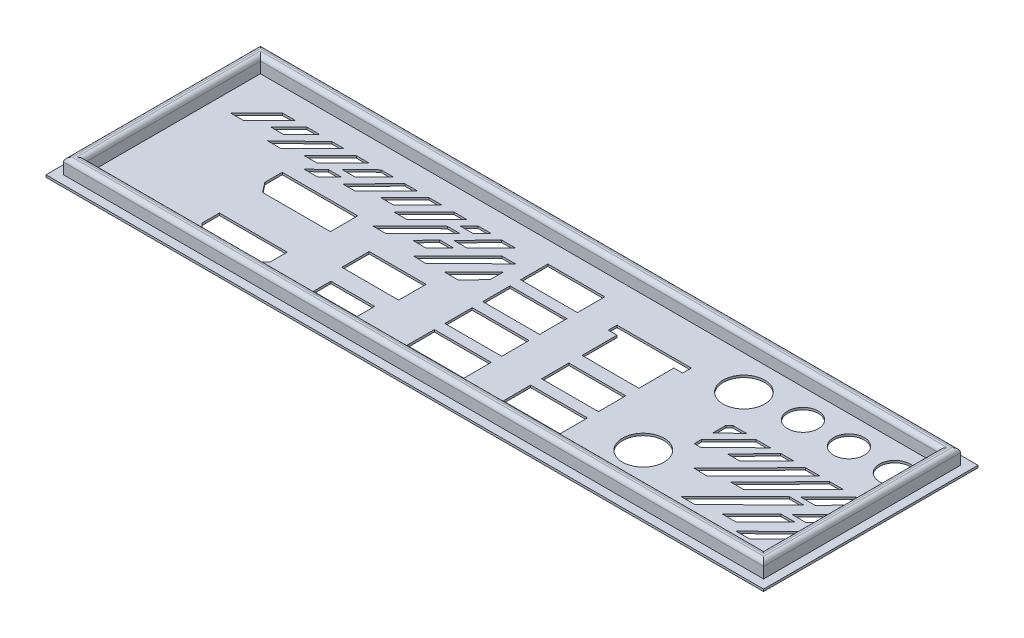
from build123d import *

# Parameters (mm, degrees)
SKETCH1_W           = 155
SKETCH1_H           = 40
BOSS_EXTRUDE1_DEPTH = 0.5
SKETCH2_W           = 160
SKETCH2_H           = 45
SKETCH2_W_2         = 155
SKETCH2_H_2         = 40
BOSS_EXTRUDE2_DEPTH = 4
FILLET1_R           = 1
SKETCH3_W           = 164
SKETCH3_H           = 49
BOSS_EXTRUDE3_DEPTH = 0.5
SKETCH5_R           = 3.5
SKETCH5_R_2         = 4.75
SKETCH5_W           = 13
SKETCH5_H           = 6.25
SKETCH5_W_2         = 10
SKETCH5_H_2         = 4
CUT_EXTRUDE1_DEPTH  = 86.653371212
CUT_EXTRUDE2_DEPTH  = 86.653371212


with BuildPart() as part:
    # Sketch1 → Boss-Extrude1 (new body)
    with BuildSketch(Plane(origin=(0, 0, 0), x_dir=(1, 0, 0), z_dir=(0, 1, 0))):
        Rectangle(SKETCH1_W, SKETCH1_H)
    extrude(amount=BOSS_EXTRUDE1_DEPTH)

    # Sketch2 → Boss-Extrude2 (add)
    with BuildSketch(Plane.XZ):
        Rectangle(SKETCH2_W, SKETCH2_H)
        Rectangle(SKETCH2_W_2, SKETCH2_H_2, mode=Mode.SUBTRACT)
    extrude(amount=-BOSS_EXTRUDE2_DEPTH)

    # Fillet1
    fillet1_edges = [part.edges().sort_by_distance(p)[0] for p in [
        (-80, 4, 0),
        (0, 4, 22.5),
        (80, 4, 0),
        (0, 4, -22.5),
        (77.5, 4, 0),
        (0, 4, 20),
        (-77.5, 4, 0),
        (0, 4, -20),
    ]]
    fillet(fillet1_edges, radius=FILLET1_R)

    # Sketch3 → Boss-Extrude3 (add)
    with BuildSketch(Plane.XZ):
        Rectangle(SKETCH3_W, SKETCH3_H)
    extrude(amount=-BOSS_EXTRUDE3_DEPTH)

    # Sketch5 → Cut-Extrude1 (cut, through all)
    with BuildSketch(Plane(origin=(0, 0.5, 0), x_dir=(1, 0, 0), z_dir=(0, 1, 0))):
        with Locations(Location((74, 13.5, 0), (0, 0, 270))):
            Circle(SKETCH5_R)
        with Locations(Location((63.5, 13.5, 0), (0, 0, 270))):
            Circle(SKETCH5_R)
        with Locations(Location((53, 13.5, 0), (0, 0, 270))):
            Circle(SKETCH5_R)
        with Locations(Location((40.75, 12.25, 0), (0, 0, 270))):
            Circle(SKETCH5_R_2)
        with Locations(Location((40.75, -10.75, 0), (0, 0, 270))):
            Circle(SKETCH5_R_2)
        with Locations((21.5, -13.875)):
            Rectangle(SKETCH5_W, SKETCH5_H)
        with Locations((21.5, -5.125)):
            Rectangle(SKETCH5_W, SKETCH5_H)
        Polygon((13, 11), (13, 9), (15, 9), (15, 1), (28, 1), (28, 9), (30, 9), (30, 11), align=None)
        with Locations((-0.5, -13.875)):
            Rectangle(SKETCH5_W, SKETCH5_H)
        with Locations((-0.5, -5.225)):
            Rectangle(SKETCH5_W, SKETCH5_H)
        with Locations((-0.5, 3.425)):
            Rectangle(SKETCH5_W, SKETCH5_H)
        with Locations((-0.5, 12.075)):
            Rectangle(SKETCH5_W, SKETCH5_H)
        with Locations((-23.389803957, -5.875)):
            Rectangle(SKETCH5_W, SKETCH5_H)
        with Locations((-23.389803957, -15)):
            Rectangle(SKETCH5_W_2, SKETCH5_H_2)
        Polygon((-55.5, 3), (-55.5, -1), (-53.75, -3.25), (-38.25, -3.25), (-38.25, 3), align=None)
        Polygon((-39.125, -12.25), (-39.125, -16.25), (-41.375, -18.25), (-52.375, -18.25), (-54.625, -16.25), (-54.625, -12.25), align=None)
    extrude(amount=-CUT_EXTRUDE1_DEPTH, mode=Mode.SUBTRACT)

    # Sketch7 → Cut-Extrude2 (cut, through all)
    with BuildSketch(Plane(origin=(0, 0.5, 0), x_dir=(1, 0, 0), z_dir=(0, 1, 0))):
        Polygon((-67.250510445, 14.746570529), (-64.239153938, 14.746570529), (-70.176868986, 8.808855481), (-73.200368059, 8.808855481), align=None)
        Polygon((-61.640644694, 14.746570529), (-58.726428719, 14.746570529), (-62.859039574, 10.622393574), (-65.744832191, 10.622393574), align=None)
        Polygon((-55.885068144, 14.746570529), (-53.165133234, 14.746570529), (-60.336027284, 7.540750618), (-63.437744545, 7.540750618), align=None)
        Polygon((-50.323772659, 14.746570529), (-47.409556685, 14.746570529), (-53.318492244, 8.808855481), (-56.346485673, 8.808855481), align=None)
        Polygon((-44.738192041, 14.746570529), (-41.896831466, 14.746570529), (-46.335248567, 10.37079238), (-49.279511935, 10.37079238), align=None)
        Polygon((-50.736619922, 8.808855481), (-47.807380251, 8.808855481), (-50.607399688, 6.110903309), (-53.686609439, 6.110903309), align=None)
        Polygon((-39.225466823, 14.746570529), (-36.262680582, 14.746570529), (-43.414652286, 7.594598825), (-46.335248567, 7.594598825), align=None)
        Polygon((-33.567030806, 14.746570529), (-30.774240497, 14.746570529), (-36.262680582, 9.225561643), (-39.225466823, 9.225561643), (-33.737026738, 14.746570529), align=None)
        Polygon((-28.039824293, 14.746570529), (-25.014130416, 14.746570529), (-31.833017792, 7.887219381), (-34.916396501, 7.887219381), align=None)
        Polygon((-22.574054709, 14.746570529), (-19.580895175, 14.746570529), (-21.648041016, 12.684601459), (-24.461046589, 12.684601459), align=None)
        Polygon((-25.957626356, 11.170584677), (-23.054543803, 11.170584677), (-31.544128494, 2.702260527), (-34.562960016, 2.702260527), align=None)
        Polygon((-27.096328353, 4.41957859), (-24.11943599, 4.41957859), (-20.893046917, 7.594598825), (-24.11943599, 7.594598825), align=None)
        Polygon((-22.378761422, 9.104350792), (-19.450757804, 9.104350792), (-13.809696196, 14.65559844), (-17.059483611, 14.65559844), align=None)
        Polygon((-23.898512836, 1.421313419), (-21.077474942, 1.328401476), (-10.722527867, 11.518482635), (-13.809696196, 11.518482635), align=None)
        Polygon((-17.270956838, 1.784296826), (-14.164624085, 1.784296826), (-10.489423725, 5.462539901), (-10.489423725, 8.583974463), align=None)
        Polygon((45.285967662, 3.623418363), (45.285967662, 0.513302694), (49.202811749, 4.367784889), (46.145186604, 4.367784889), align=None)
        Polygon((45.285967662, -2.026996785), (45.285967662, -3.633362633), (46.817618819, -3.633362633), (54.819393397, 4.241011979), (51.562001671, 4.241011979), align=None)
        Polygon((51.188428218, -1.877567404), (53.990229114, -1.877567404), (60.195561112, 4.319829757), (57.092895113, 4.319829757), align=None)
        Polygon((50.067707859, -8.508496193), (53.057358815, -8.606961469), (66.000700856, 4.319829757), (62.750526584, 4.319829757), align=None)
        Polygon((68.242056341, 4.319829757), (71.305358655, 4.319829757), (60.033658541, -7.081188124), (57.092895113, -7.081188124), align=None)
        Polygon((74.235786126, 4.241011979), (75.951599175, 4.241011979), (75.951599175, 2.702260527), (71.305358655, -2.048937359), (68.051709926, -2.048937359), align=None)
        Polygon((75.808614755, -1.231673392), (75.808614755, -4.252219282), (73.574483179, -6.486350857), (70.518191185, -6.486350857), (75.772868649, -1.231673392), align=None)
        Polygon((75.808614755, -7.969814223), (75.808614755, -10.883121797), (70.518191185, -16.173545367), (67.354660874, -16.173545367), align=None)
        Polygon((69.088346976, -7.665972329), (72.305496445, -7.665972329), (65.603005834, -14.36846294), (62.475317514, -14.36846294), align=None)
        Polygon((66.621865717, -3.251328336), (69.981999606, -3.251328336), (57.399370575, -15.619480737), (54.200094159, -15.619480737), align=None)
    extrude(amount=-CUT_EXTRUDE2_DEPTH, mode=Mode.SUBTRACT)


solid = part.part
